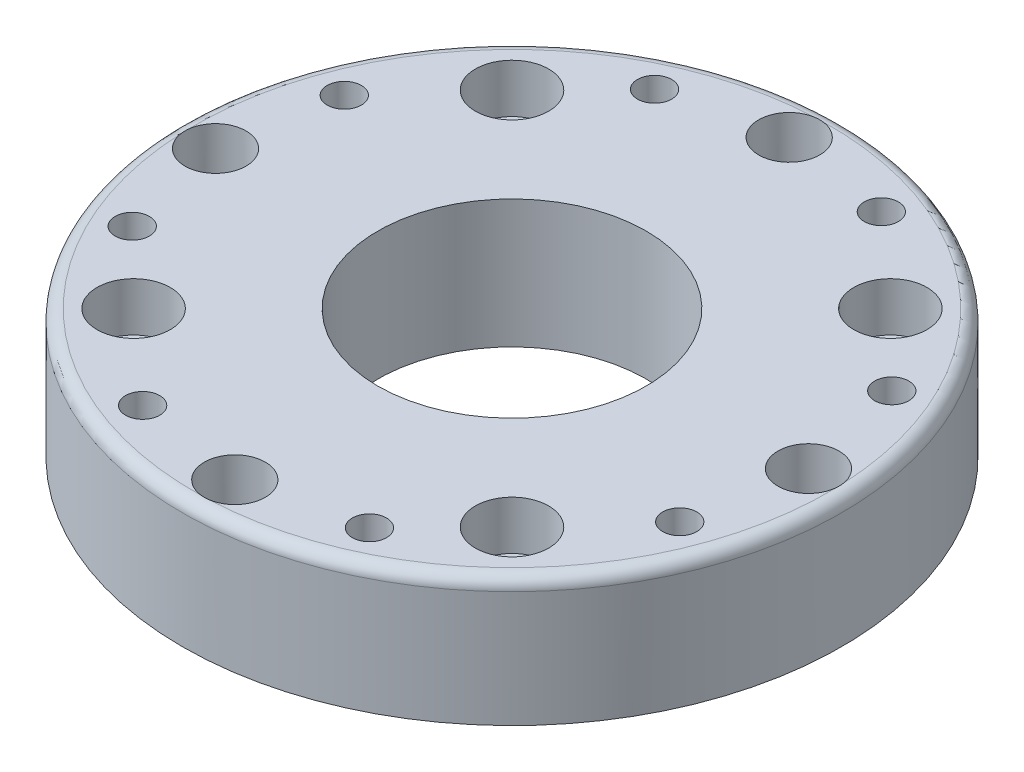
from build123d import *

# Parameters (mm, degrees)
SKETCH2_R                      = 27
BOSS_EXTRUDE1_DEPTH            = 10.5
SKETCH3_R                      = 1.6
NEMA_MOUNTS_HOLES_M3_DEPTH     = 10.5
SKETCH3_4_R                    = 3
NEMA_MOUNT_HOLES_CAP_6MM_DEPTH = 4
SKETCH5_R                      = 1.4
REDUCER_HOLES_M2_5_DEPTH       = 10.5
REDUCER_NUTS_M2_5_DEPTH        = 4
SKETCH9_R                      = 11
SHAFT_SKIRT_22MM_DEPTH         = 10.5
FILLET1_R                      = 1
CUT_EXTRUDE1_START             = -10.5
SKETCH10_R                     = 2.5
CUT_EXTRUDE1_DEPTH             = 5
FILLET3_R                      = 1


with BuildPart() as part:
    # Sketch2 → Boss-Extrude1 (new body)
    with BuildSketch(Plane(origin=(0, 693.868908512, 0), x_dir=(-1, 0, 0), z_dir=(0, 1, 0))):
        with Locations(Location((-1181.798443484, 915.067639521, 0), (0, 0, 270))):
            Circle(SKETCH2_R)
    extrude(amount=BOSS_EXTRUDE1_DEPTH)

    # Sketch3 → Nema_Mounts_holes_M3 (cut)
    with BuildSketch(Plane(origin=(0, 704.368908512, 0), x_dir=(-1, 0, 0), z_dir=(0, 1, 0))):
        with Locations(Location((-1197.298443484, 930.567639521, 0), (0, 0, 90))):
            Circle(SKETCH3_R)
        with Locations(Location((-1166.298443484, 930.567639521, 0), (0, 0, 90))):
            Circle(SKETCH3_R)
        with Locations(Location((-1197.298443484, 899.567639521, 0), (0, 0, 90))):
            Circle(SKETCH3_R)
        with Locations(Location((-1166.298443484, 899.567639521, 0), (0, 0, 90))):
            Circle(SKETCH3_R)
    extrude(amount=-NEMA_MOUNTS_HOLES_M3_DEPTH, mode=Mode.SUBTRACT)

    # Sketch3<4> → Nema_Mount_holes_cap_6mm (cut)
    with BuildSketch(Plane(origin=(0, 704.368908512, 0), x_dir=(-1, 0, 0), z_dir=(0, 1, 0))):
        with Locations(Location((-1197.298443484, 930.567639521, 0), (0, 0, 90))):
            Circle(SKETCH3_4_R)
        with Locations(Location((-1166.298443484, 930.567639521, 0), (0, 0, 90))):
            Circle(SKETCH3_4_R)
        with Locations(Location((-1197.298443484, 899.567639521, 0), (0, 0, 90))):
            Circle(SKETCH3_4_R)
        with Locations(Location((-1166.298443484, 899.567639521, 0), (0, 0, 90))):
            Circle(SKETCH3_4_R)
    extrude(amount=-NEMA_MOUNT_HOLES_CAP_6MM_DEPTH, mode=Mode.SUBTRACT)

    # Sketch5 → Reducer_Holes_M2.5 (cut)
    with BuildSketch(Plane(origin=(0, 704.368908512, 0), x_dir=(-1, 0, 0), z_dir=(0, 1, 0))):
        with Locations(Location((-1160.401515615, 924.78471098, 0), (0, 0, 90))):
            Circle(SKETCH5_R)
        with Locations(Location((-1159.797523569, 906.80873385, 0), (0, 0, 90))):
            Circle(SKETCH5_R)
        with Locations(Location((-1172.081372025, 893.670711651, 0), (0, 0, 90))):
            Circle(SKETCH5_R)
        with Locations(Location((-1190.057349155, 893.066719605, 0), (0, 0, 90))):
            Circle(SKETCH5_R)
        with Locations(Location((-1203.195371354, 905.350568061, 0), (0, 0, 90))):
            Circle(SKETCH5_R)
        with Locations(Location((-1203.7993634, 923.326545192, 0), (0, 0, 90))):
            Circle(SKETCH5_R)
        with Locations(Location((-1191.515514944, 936.46456739, 0), (0, 0, 90))):
            Circle(SKETCH5_R)
        with Locations(Location((-1173.539537814, 937.068559436, 0), (0, 0, 90))):
            Circle(SKETCH5_R)
    extrude(amount=-REDUCER_HOLES_M2_5_DEPTH, mode=Mode.SUBTRACT)

    # Sketch6 → Reducer_Nuts_M2.5 (cut)
    with BuildSketch(Plane.XZ.offset(-693.868908512)):
        Polygon((1176.236307168, 938.098495541), (1173.99597166, 939.918998258), (1171.299202305, 938.889062153), (1170.842768459, 936.038623331), (1173.083103967, 934.218120614), (1175.779873322, 935.248056719), align=None)
        Polygon((1162.094332768, 922.446398892), (1163.272961862, 925.081577594), (1161.580144709, 927.419889682), (1158.708698462, 927.123023068), (1157.530069368, 924.487844366), (1159.222886521, 922.149532278), align=None)
        Polygon((1194.150693646, 935.285938296), (1193.853827032, 938.157384543), (1191.21864833, 939.336013637), (1188.880336242, 937.643196484), (1189.177202856, 934.771750238), (1191.812381558, 933.593121144), align=None)
        Polygon((1204.829299505, 920.629775837), (1206.649802222, 922.870111345), (1205.619866117, 925.5668807), (1202.769427295, 926.023314546), (1200.948924578, 923.782979038), (1201.978860683, 921.086209683), align=None)
        Polygon((1202.01674226, 902.715389359), (1204.888188506, 903.012255973), (1206.0668176, 905.647434675), (1204.374000448, 907.985746763), (1201.502554201, 907.688880149), (1200.323925107, 905.053701447), align=None)
        Polygon((1187.3605798, 892.0367835), (1189.600915309, 890.216280784), (1192.297684664, 891.246216889), (1192.75411851, 894.096655711), (1190.513783001, 895.917158427), (1187.817013647, 894.887222322), align=None)
        Polygon((1169.446193323, 894.849340745), (1169.743059937, 891.977894499), (1172.378238639, 890.799265405), (1174.716550727, 892.492082557), (1174.419684113, 895.363528804), (1171.784505411, 896.542157898), align=None)
        Polygon((1158.767587464, 909.505503205), (1156.947084747, 907.265167696), (1157.977020852, 904.568398341), (1160.827459674, 904.111964495), (1162.647962391, 906.352300004), (1161.618026286, 909.049069359), align=None)
    extrude(amount=-REDUCER_NUTS_M2_5_DEPTH, mode=Mode.SUBTRACT)

    # Sketch9 → Shaft_skirt_22mm (cut)
    with BuildSketch(Plane(origin=(0, 693.868908512, 0), x_dir=(-1, 0, 0), z_dir=(0, -1, 0))):
        with Locations(Location((-1181.798443484, -915.067639521, 0), (0, 0, 90))):
            Circle(SKETCH9_R)
    extrude(amount=-SHAFT_SKIRT_22MM_DEPTH, mode=Mode.SUBTRACT)

    # Fillet1
    fillet1_edges = [part.edges().sort_by_distance(p)[0] for p in [
        (1181.798443484, 704.368908512, 942.067639521),
    ]]
    fillet(fillet1_edges, radius=FILLET1_R)

    # Sketch10 → Cut-Extrude1 (cut)
    with BuildSketch(Plane.XZ.offset(-693.868908512).offset(CUT_EXTRUDE1_START)):
        with Locations(Location((1182.58828203, 938.567639521, 0), (0, 0, 90))):
            Circle(SKETCH10_R)
        with Locations(Location((1205.298443484, 914.277800975, 0), (0, 0, 90))):
            Circle(SKETCH10_R)
        with Locations(Location((1181.008604939, 891.567639521, 0), (0, 0, 90))):
            Circle(SKETCH10_R)
        with Locations(Location((1158.298443484, 915.857478067, 0), (0, 0, 90))):
            Circle(SKETCH10_R)
    extrude(amount=CUT_EXTRUDE1_DEPTH, mode=Mode.SUBTRACT)

    # Fillet3
    fillet3_edges = [part.edges().sort_by_distance(p)[0] for p in [
        (1182.58828203, 699.368908512, 936.067639521),
        (1205.298443484, 699.368908512, 911.777800975),
        (1181.008604939, 699.368908512, 889.067639521),
        (1158.298443484, 699.368908512, 913.357478067),
    ]]
    fillet(fillet3_edges, radius=FILLET3_R)


solid = part.part
